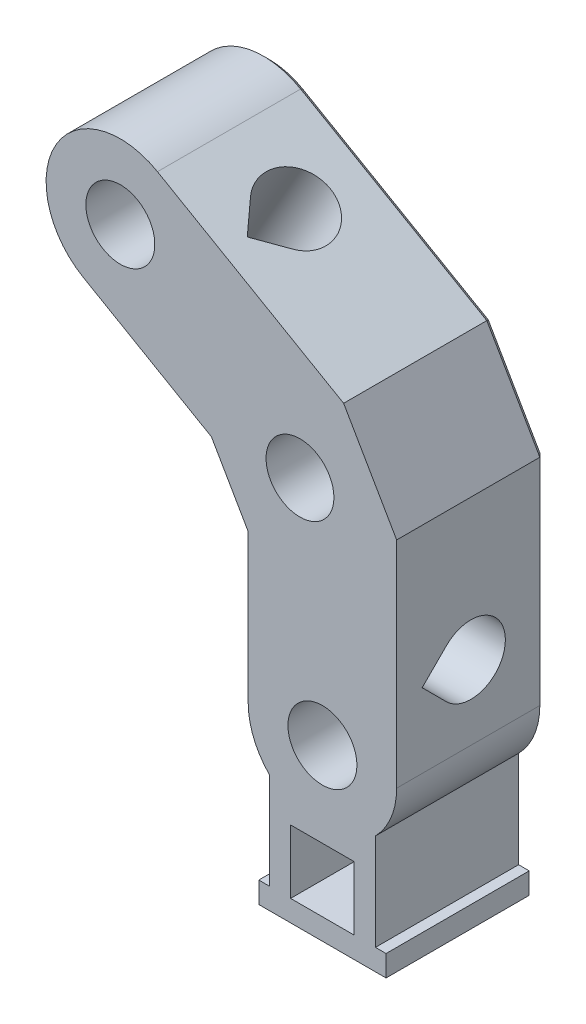
from build123d import *

# Parameters (mm, degrees)
SKETCH1_W           = 6
SKETCH1_H           = 6
BOSS_EXTRUDE1_DEPTH = 14
HOLE2_D             = 6.5
HOLE1_D             = 6.5
CUT_EXTRUDE2_DEPTH  = 47.465040622
CUT_EXTRUDE1_DEPTH  = 46.814563472
SKETCH8_R           = 3.2
CUT_EXTRUDE3_DEPTH  = 50.746716719
CHAMFER1_SIZE       = 0.5


with BuildPart() as part:
    # Sketch1 → Boss-Extrude1 (new body)
    with BuildSketch(Plane.XY.offset(14)):
        with BuildLine():
            Line((7, 0), (7, 20.267949192))
            Line((7, 20.267949192), (2, 28.92820323))
            Line((2, 28.92820323), (-15.552558883, 39.062177826))
            ThreePointArc((-15.552558883, 39.062177826), (-25.11473671, 36.5), (-22.552558883, 26.937822174))
            Line((-22.552558883, 26.937822174), (-10.464101615, 19.958548116))
            Line((-10.464101615, 19.958548116), (-7, 13.958548116))
            Line((-7, 13.958548116), (-7, 0))
            ThreePointArc((-7, 0), (-6.480740698, -2.645751311), (-5, -4.898979486))
            Line((-5, -4.898979486), (-5, -14))
            Line((-5, -14), (-6, -14))
            Line((-6, -14), (-6, -16))
            Line((-6, -16), (6, -16))
            Line((6, -16), (6, -14))
            Line((6, -14), (5, -14))
            Line((5, -14), (5, -4.898979486))
            ThreePointArc((5, -4.898979486), (6.480740698, -2.645751311), (7, 0))
        make_face()
        with Locations((0, -11)):
            Rectangle(SKETCH1_W, SKETCH1_H, mode=Mode.SUBTRACT)
    extrude(amount=-BOSS_EXTRUDE1_DEPTH)

    # Hole2 (through all)
    with Locations(Plane(origin=(0, 0, 0), x_dir=(-1, 0, 0), z_dir=(0, 0, -1))):
        with Locations((19.0525, 32.999898011)):
            Hole(HOLE2_D / 2)

    # Hole1 (through all)
    with Locations(Plane(origin=(0, 0, 0), x_dir=(-1, 0, 0), z_dir=(0, 0, -1))):
        with Locations((0, 0)):
            Hole(HOLE1_D / 2)

    # Sketch3 → Cut-Extrude2 (cut, through all)
    with BuildSketch(Plane.ZY.offset(7)):
        with BuildLine():
            Line((9.298097039, 4.701902961), (11.596194078, 7))
            Line((11.596194078, 7), (9.298097039, 9.298097039))
            ThreePointArc((9.298097039, 9.298097039), (3.75, 7), (9.298097039, 4.701902961))
        make_face()
    extrude(amount=-CUT_EXTRUDE2_DEPTH, mode=Mode.SUBTRACT)

    # Sketch2 → Cut-Extrude1 (cut, through all)
    with BuildSketch(Plane(origin=(6.026279442, 10.437822174, 0), x_dir=(0.8660254037844398, -0.49999999999999806, 0), z_dir=(-0.499999999999998, -0.8660254037844397, 0))):
        with BuildLine():
            Line((-25.999898011, 11.596194078), (-28.29799505, 9.298097039))
            ThreePointArc((-28.29799505, 9.298097039), (-25.999898011, 3.75), (-23.701800972, 9.298097039))
            Line((-23.701800972, 9.298097039), (-25.999898011, 11.596194078))
        make_face()
    extrude(amount=-CUT_EXTRUDE1_DEPTH, mode=Mode.SUBTRACT)

    # Sketch8 → Cut-Extrude3 (cut, through all)
    with BuildSketch(Plane.XY.offset(14)):
        with Locations((-2.116025404, 20.778312164)):
            Circle(SKETCH8_R)
    extrude(amount=-CUT_EXTRUDE3_DEPTH, mode=Mode.SUBTRACT)

    # Chamfer1
    chamfer1_edges = [part.edges().sort_by_distance(p)[0] for p in [
        (-22.3025, 32.999898011, 0),
        (-3.25, 0, 0),
        (-5.316025404, 20.778312164, 0),
        (0, -16, 0),
        (6, -15, 0),
        (5.5, -14, 0),
        (5, -9.449489743, 0),
        (6.480740698, -2.645751311, 0),
        (7, 10.133974596, 0),
        (4.5, 24.598076211, 0),
        (-6.776279442, 33.995190528, 0),
        (-25.11473671, 36.5, 0),
        (-16.508330249, 23.448185145, 0),
        (-8.732050808, 16.958548116, 0),
        (-7, 6.979274058, 0),
        (-6.480740698, -2.645751311, 0),
        (-5, -9.449489743, 0),
        (-5.5, -14, 0),
        (-6, -15, 0),
        (0, -8, 0),
        (3, -11, 0),
        (0, -14, 0),
        (-3, -11, 0),
    ]]
    chamfer(chamfer1_edges, length=CHAMFER1_SIZE)


solid = part.part
